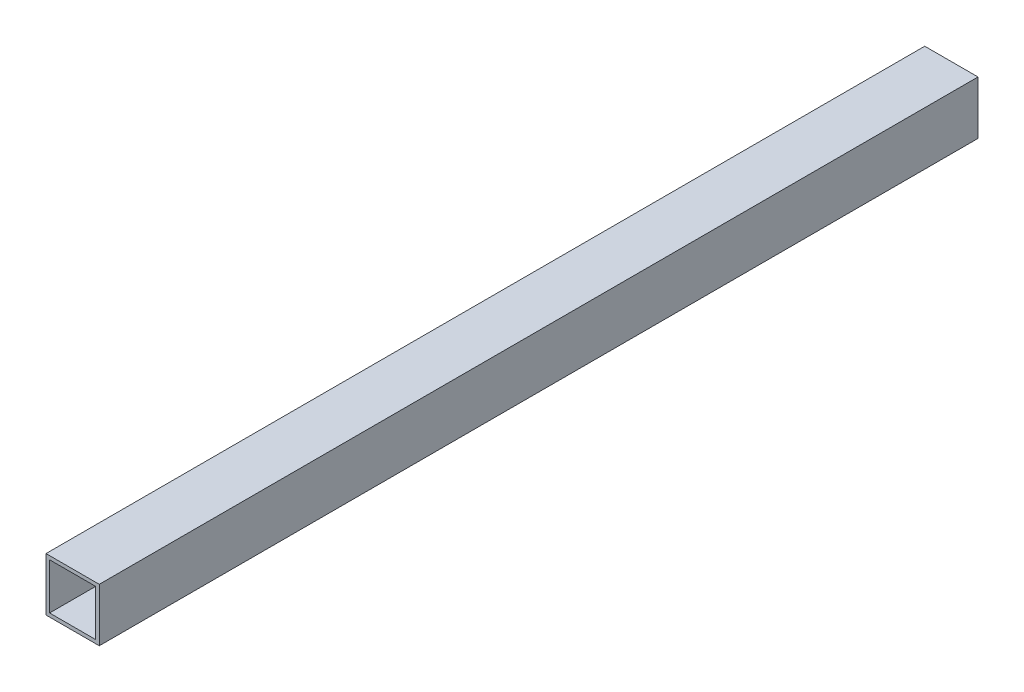
from build123d import *

# Parameters (mm, degrees)
SKETCH1_W           = 25.4
SKETCH1_H           = 25.4
SKETCH1_W_2         = 21.971
SKETCH1_H_2         = 21.971
BOSS_EXTRUDE1_DEPTH = 209.55


with BuildPart() as part:
    # Sketch1 → Boss-Extrude1 (new, symmetric)
    with BuildSketch(Plane.XY):
        Rectangle(SKETCH1_W, SKETCH1_H)
        Rectangle(SKETCH1_W_2, SKETCH1_H_2, mode=Mode.SUBTRACT)
    extrude(amount=BOSS_EXTRUDE1_DEPTH, both=True)


solid = part.part
